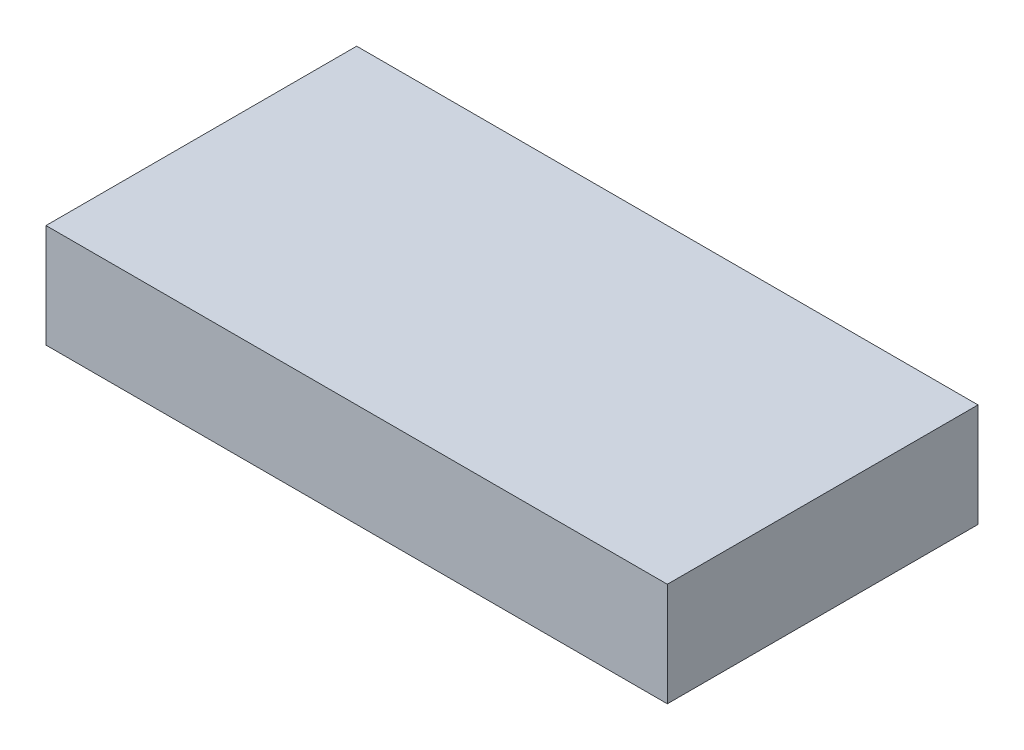
from build123d import *

# Parameters (mm, degrees)
SKETCH1_W           = 24
SKETCH1_H           = 12
BOSS_EXTRUDE1_DEPTH = 4


with BuildPart() as part:
    # Sketch1 → Boss-Extrude1 (new body)
    with BuildSketch(Plane(origin=(0, 0, 0), x_dir=(1, 0, 0), z_dir=(0, 1, 0))):
        Rectangle(SKETCH1_W, SKETCH1_H)
    extrude(amount=BOSS_EXTRUDE1_DEPTH)


solid = part.part
